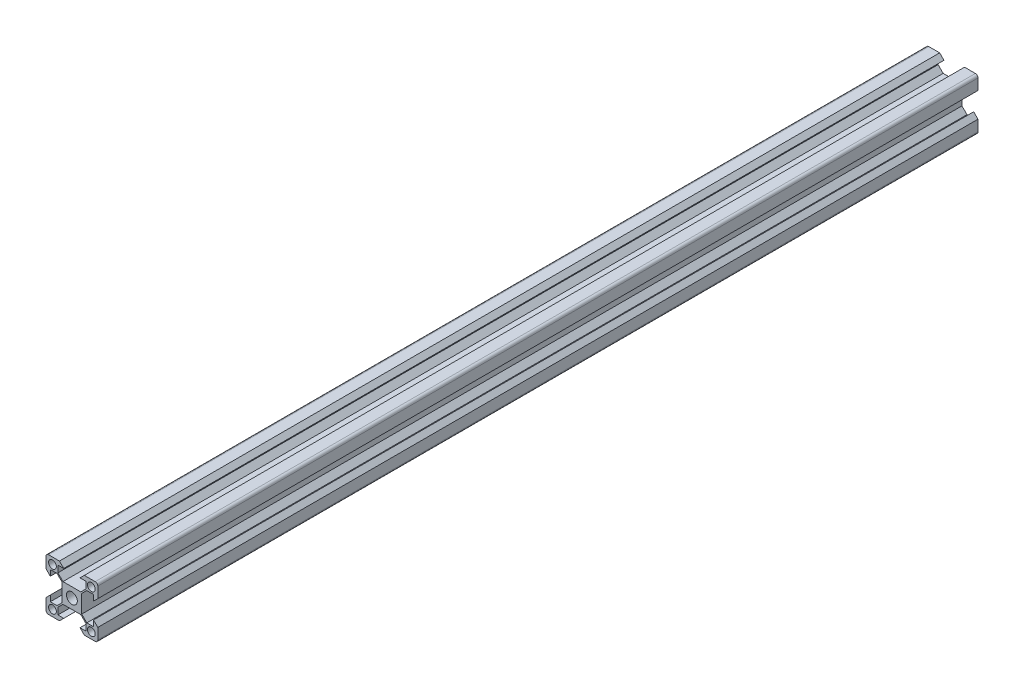
from build123d import *

# Parameters (mm, degrees)
SKETCH_1_R      = 1.5
SKETCH_1_R_2    = 2.1
EXTRUDE_1_DEPTH = 170
FILLET_1_R      = 1


with BuildPart() as part:
    # 草图1 → 凸台-拉伸1 (new, symmetric)
    with BuildSketch(Plane.XY):
        Polygon((-10, 10), (-10, 4.8), (-8.34, 3.14), (-8.34, 5.4), (-5.753553391, 5.4), (-3.8, 3.446446609), (-3.8, -3.446446609), (-5.753553391, -5.4), (-8.34, -5.4), (-8.34, -3.14), (-10, -4.8), (-10, -10), (-4.8, -10), (-3.14, -8.34), (-5.4, -8.34), (-5.4, -5.753553391), (-3.446446609, -3.8), (3.446446609, -3.8), (5.4, -5.753553391), (5.4, -8.34), (3.14, -8.34), (4.8, -10), (10, -10), (10, -4.8), (8.34, -3.14), (8.34, -5.4), (5.753553391, -5.4), (3.8, -3.446446609), (3.8, 3.446446609), (5.753553391, 5.4), (8.34, 5.4), (8.34, 3.14), (10, 4.8), (10, 10), (4.8, 10), (3.14, 8.34), (5.4, 8.34), (5.4, 5.753553391), (3.446446609, 3.8), (-3.446446609, 3.8), (-5.4, 5.753553391), (-5.4, 8.34), (-3.14, 8.34), (-4.8, 10), align=None)
        with Locations((-7.5, 7.5)):
            Circle(SKETCH_1_R, mode=Mode.SUBTRACT)
        Circle(SKETCH_1_R_2, mode=Mode.SUBTRACT)
        with Locations(Location((-7.5, -7.5, 0), (0, 0, 180))):
            Circle(SKETCH_1_R, mode=Mode.SUBTRACT)
        with Locations((7.5, -7.5)):
            Circle(SKETCH_1_R, mode=Mode.SUBTRACT)
        with Locations(Location((7.5, 7.5, 0), (0, 0, 180))):
            Circle(SKETCH_1_R, mode=Mode.SUBTRACT)
    extrude(amount=EXTRUDE_1_DEPTH, both=True)

    # 圆角1
    fillet_1_edges = [part.edges().sort_by_distance(p)[0] for p in [
        (10, 10, 0),
        (10, -10, 0),
        (-10, -10, 0),
        (-10, 10, 0),
    ]]
    fillet(fillet_1_edges, radius=FILLET_1_R)


solid = part.part
